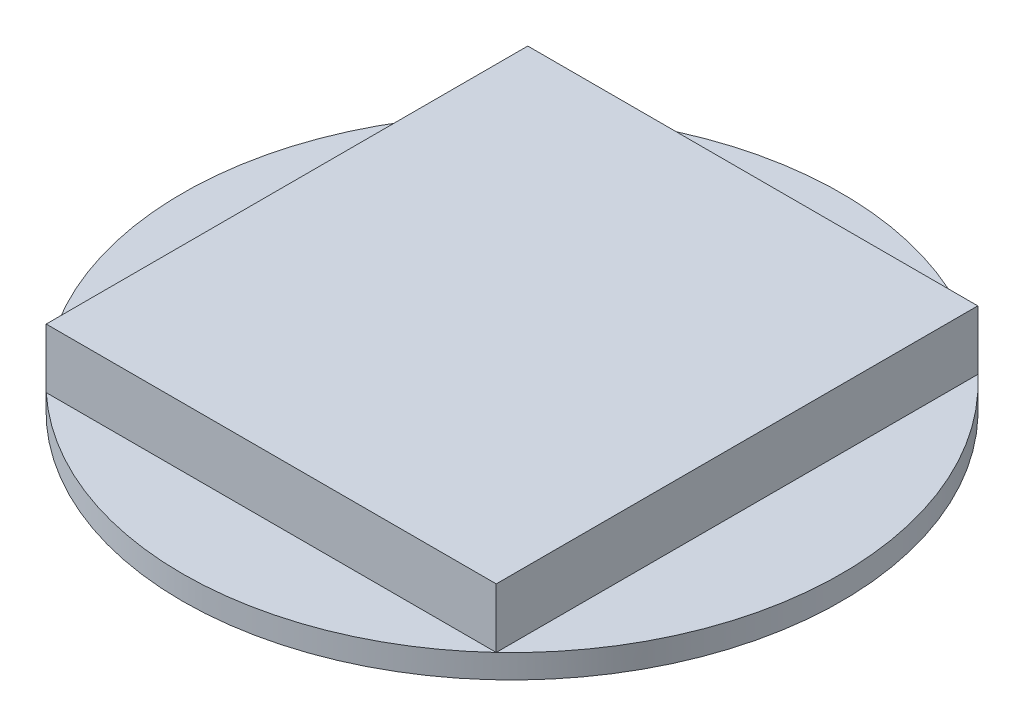
from build123d import *

# Parameters (mm, degrees)
BOSS_EXTRUDE1_DEPTH      = 10
BOSS_EXTRUDE1_DEPTH_BACK = 10
SKETCH1_R                = 277.5
SKETCH2_W                = 378.949229626
SKETCH2_H                = 405.490420806
BOSS_EXTRUDE2_DEPTH      = 50


with BuildPart() as part:
    # Sketch1 → Boss-Extrude1 (new, two sides: drawn at the far end of the back side and taken through both)
    with BuildSketch(Plane(origin=(0, 0, 0), x_dir=(1, 0, 0), z_dir=(0, 1, 0)).offset(-BOSS_EXTRUDE1_DEPTH_BACK)):
        Circle(SKETCH1_R)
    extrude(amount=BOSS_EXTRUDE1_DEPTH + BOSS_EXTRUDE1_DEPTH_BACK)

    # Sketch2 → Boss-Extrude2 (add)
    with BuildSketch(Plane(origin=(0, 10, 0), x_dir=(1, 0, 0), z_dir=(0, 1, 0))):
        Rectangle(SKETCH2_W, SKETCH2_H)
    extrude(amount=BOSS_EXTRUDE2_DEPTH)


solid = part.part
